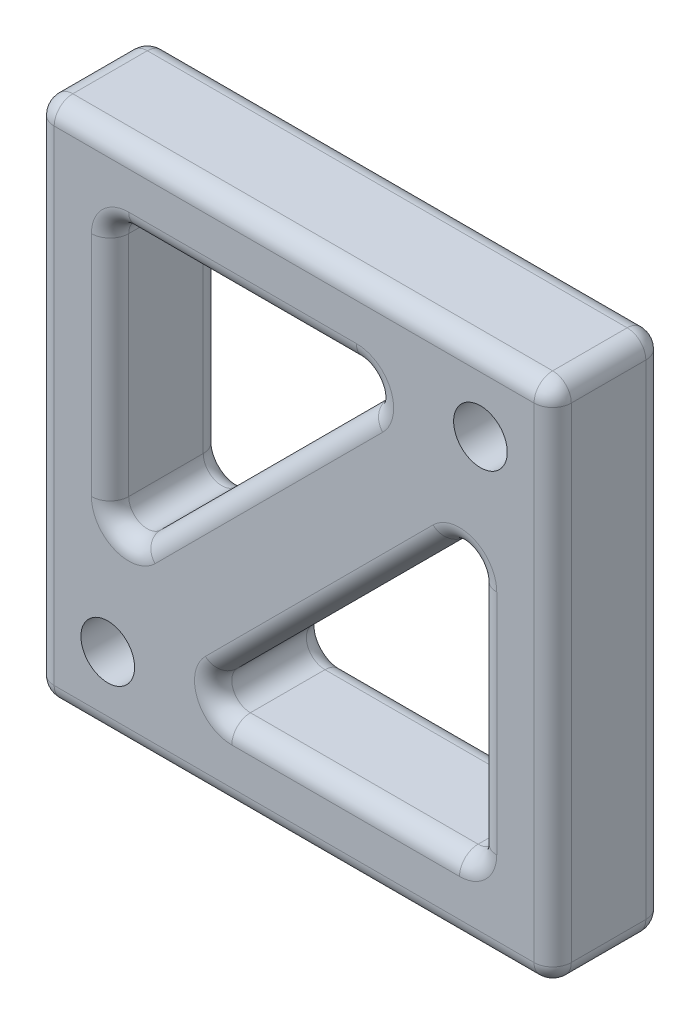
from build123d import *

# Parameters (mm, degrees)
SKETCH1_W           = 44.05525725
SKETCH1_H           = 44.45
BOSS_EXTRUDE1_DEPTH = 9.525
SKETCH2_R           = 2.286
CUT_EXTRUDE1_DEPTH  = 64.303979467
CUT_EXTRUDE2_DEPTH  = 64.303979467
FILLET1_R           = 1.5875


with BuildPart() as part:
    # Sketch1 → Boss-Extrude1 (new body)
    with BuildSketch(Plane.XY):
        with Locations((22.027628625, 22.225)):
            Rectangle(SKETCH1_W, SKETCH1_H)
    extrude(amount=BOSS_EXTRUDE1_DEPTH)

    # Sketch2 → Cut-Extrude1 (cut, through all)
    with BuildSketch(Plane(origin=(0, 0, 0), x_dir=(-1, 0, 0), z_dir=(0, 0, -1))):
        with Locations((-37.902628625, 38.1)):
            Circle(SKETCH2_R)
        with Locations((-6.152628625, 6.35)):
            Circle(SKETCH2_R)
    extrude(amount=-CUT_EXTRUDE1_DEPTH, mode=Mode.SUBTRACT)

    # Sketch3 → Cut-Extrude2 (cut, through all)
    with BuildSketch(Plane(origin=(0, 0, 0), x_dir=(-1, 0, 0), z_dir=(0, 0, -1))):
        Polygon((-31.167436534, 38.1), (-6.35, 38.1), (-6.35, 13.282563466), align=None)
        Polygon((-37.70525725, 31.167436534), (-12.887820716, 6.35), (-37.70525725, 6.35), align=None)
    extrude(amount=-CUT_EXTRUDE2_DEPTH, mode=Mode.SUBTRACT)

    # Fillet1
    fillet1_edges = [part.edges().sort_by_distance(p)[0] for p in [
        (44.05525725, 22.225, 9.525),
        (22.027628625, 44.45, 9.525),
        (37.70525725, 18.758718267, 9.525),
        (37.70525725, 6.35, 4.7625),
        (25.296538983, 18.758718267, 9.525),
        (37.70525725, 31.167436534, 4.7625),
        (25.296538983, 6.35, 9.525),
        (12.887820716, 6.35, 4.7625),
        (37.70525725, 18.758718267, 0),
        (25.296538983, 6.35, 0),
        (25.296538983, 18.758718267, 0),
        (18.758718267, 25.691281733, 9.525),
        (6.35, 13.282563466, 4.7625),
        (18.758718267, 38.1, 9.525),
        (31.167436534, 38.1, 4.7625),
        (6.35, 25.691281733, 9.525),
        (6.35, 38.1, 4.7625),
        (18.758718267, 25.691281733, 0),
        (6.35, 25.691281733, 0),
        (18.758718267, 38.1, 0),
        (0, 22.225, 9.525),
        (22.027628625, 44.45, 0),
        (44.05525725, 22.225, 0),
        (22.027628625, 0, 0),
        (0, 22.225, 0),
        (0, 44.45, 4.7625),
        (44.05525725, 44.45, 4.7625),
        (44.05525725, 0, 4.7625),
        (0, 0, 4.7625),
        (22.027628625, 0, 9.525),
    ]]
    fillet(fillet1_edges, radius=FILLET1_R)


solid = part.part
